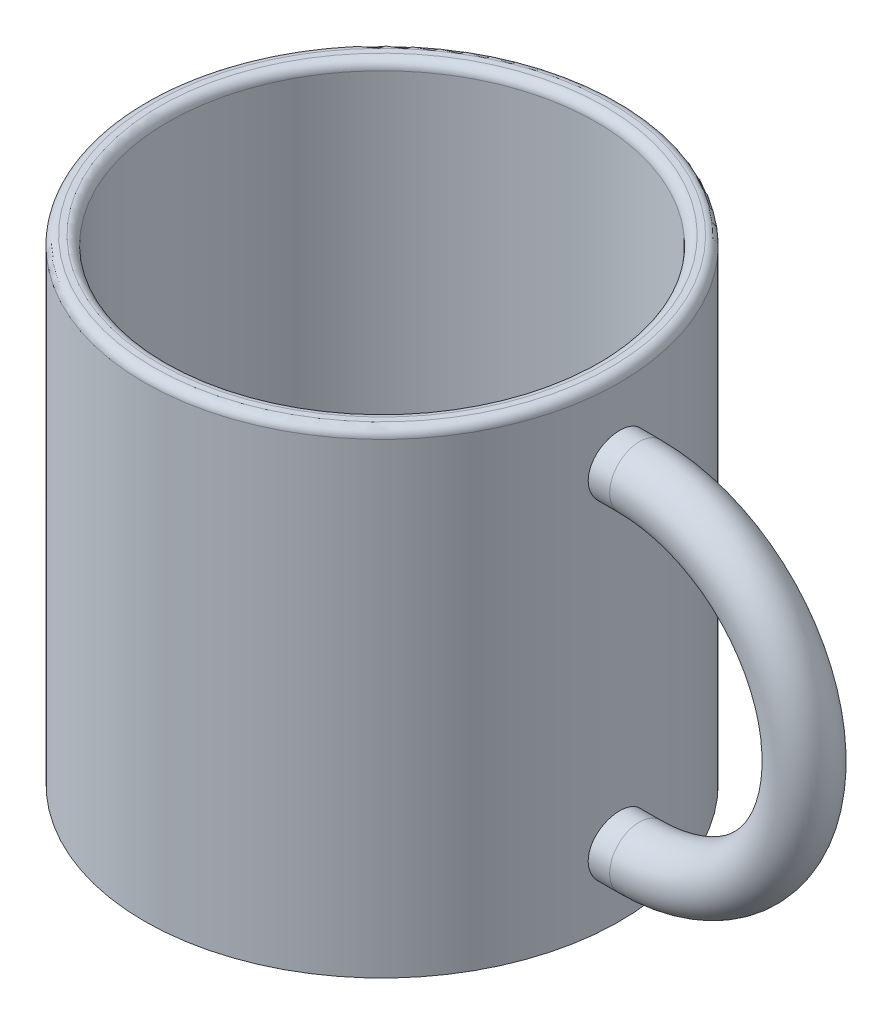
from build123d import *

# Parameters (mm, degrees)
SKETCH1_R          = 20
EXTRUDE1_DEPTH     = 40
SKETCH2_R          = 2.5
SKETCH4_R          = 18
CUT_EXTRUDE1_DEPTH = 38
FILLET1_R          = 0.75
FILLET2_R          = 0.75
SCALE1_SCALE       = 2.5
SCALE2_SCALE       = 1.2


with BuildPart() as part:
    # Sketch1 → Extrude1 (new body)
    with BuildSketch(Plane(origin=(0, 0, 0), x_dir=(1, 0, 0), z_dir=(0, 1, 0))):
        with Locations(Location((0, 0, 0), (0, 0, 270))):
            Circle(SKETCH1_R)
    extrude(amount=EXTRUDE1_DEPTH)

    # Sweep1: sweep along a path in Sketch3
    with BuildLine(Plane.XY) as sweep1_path:
        Line((0, 30.773001508), (21.65, 30.773001508))
        ThreePointArc((21.65, 30.773001508), (33.01, 19.413001508), (21.65, 8.053001508))
        Line((21.65, 8.053001508), (0, 8.053001508))
    # Sketch2 → Sweep1 (sweep)
    with BuildSketch(Plane(origin=(0, 0, 0), x_dir=(0, 0, -1), z_dir=(1, 0, 0))):
        with Locations((0, 33.273001508)):
            Circle(SKETCH2_R)
    sweep(path=sweep1_path.line)

    # Sketch4 → Cut-Extrude1 (cut)
    with BuildSketch(Plane(origin=(0, 40, 0), x_dir=(-1, 0, 0), z_dir=(0, 1, 0))):
        with Locations(Location((0, 0, 0), (0, 0, 90))):
            Circle(SKETCH4_R)
    extrude(amount=-CUT_EXTRUDE1_DEPTH, mode=Mode.SUBTRACT)

    # Fillet1
    fillet1_edges = [part.edges().sort_by_distance(p)[0] for p in [
        (0, 40, -18),
        (0, 40, -20),
    ]]
    fillet(fillet1_edges, radius=FILLET1_R)

    # Fillet2
    fillet2_edges = [part.edges().sort_by_distance(p)[0] for p in [
        (0, 2, -18),
    ]]
    fillet(fillet2_edges, radius=FILLET2_R)


with BuildPart() as part_1:
    # Scale1: scaled about (2.20106248, 16.795397828, 0.000103391)
    add(part.part.scale(SCALE1_SCALE).moved(Location((-3.30159372, -25.193096742, -0.000155087))))


with BuildPart() as part_2:
    # Scale2: scaled about (2.201062481, 16.795397829, 0.000103391)
    add(part_1.part.scale(SCALE2_SCALE).moved(Location((-0.440212496, -3.359079566, -2.0678e-05))))


solid = part_2.part
